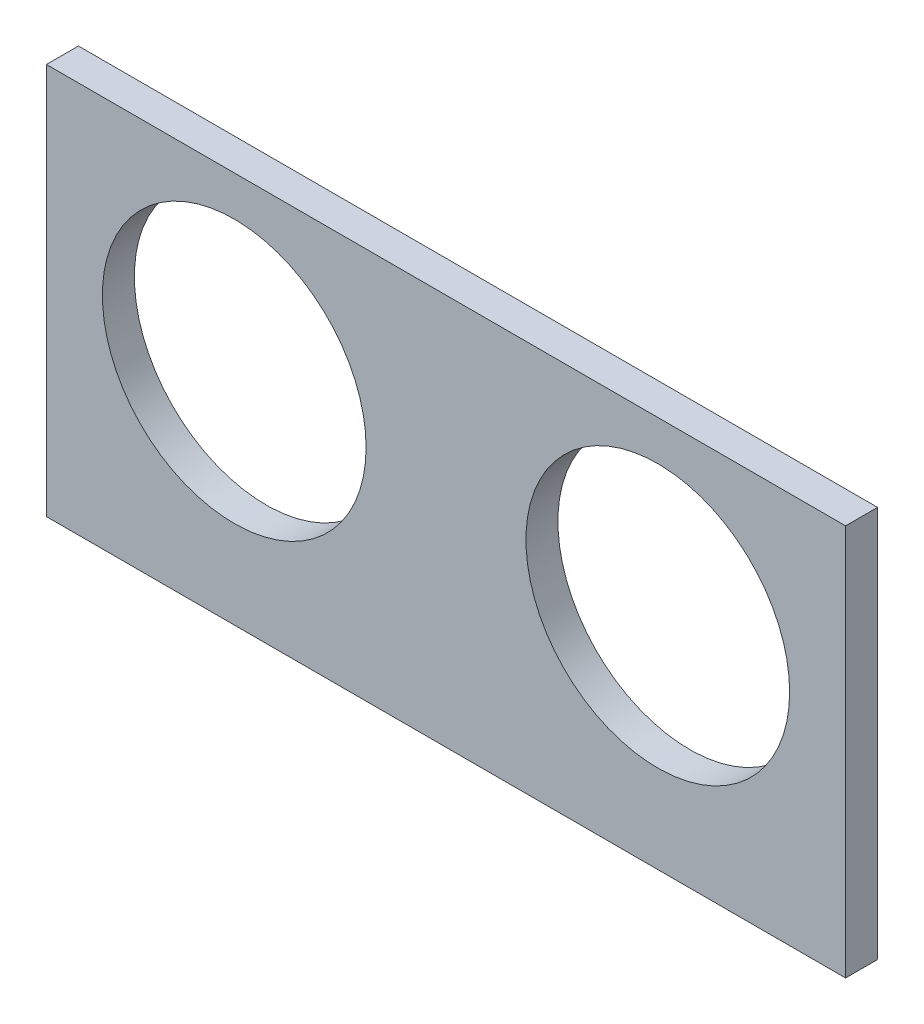
from build123d import *

# Parameters (mm, degrees)
SKETCH1_W           = 50
SKETCH1_H           = 22.5
BOSS_EXTRUDE1_DEPTH = 2
SKETCH2_R           = 8.25
CUT_EXTRUDE1_DEPTH  = 2
SKETCH3_W           = 50
SKETCH3_H           = 2
BOSS_EXTRUDE2_DEPTH = 2


with BuildPart() as part:
    # Sketch1 → Boss-Extrude1 (new body)
    with BuildSketch(Plane.XY):
        with Locations((25, 11.25)):
            Rectangle(SKETCH1_W, SKETCH1_H)
    extrude(amount=BOSS_EXTRUDE1_DEPTH)

    # Sketch2 → Cut-Extrude1 (cut)
    with BuildSketch(Plane.XY.offset(2)):
        with Locations((11.75, 13.75)):
            Circle(SKETCH2_R)
        with Locations((38.25, 13.75)):
            Circle(SKETCH2_R)
    extrude(amount=-CUT_EXTRUDE1_DEPTH, mode=Mode.SUBTRACT)

    # Sketch3 → Boss-Extrude2 (add)
    with BuildSketch(Plane(origin=(0, 22.5, 0), x_dir=(1, 0, 0), z_dir=(0, 1, 0))):
        with Locations((25, -1)):
            Rectangle(SKETCH3_W, SKETCH3_H)
    extrude(amount=BOSS_EXTRUDE2_DEPTH)


solid = part.part
